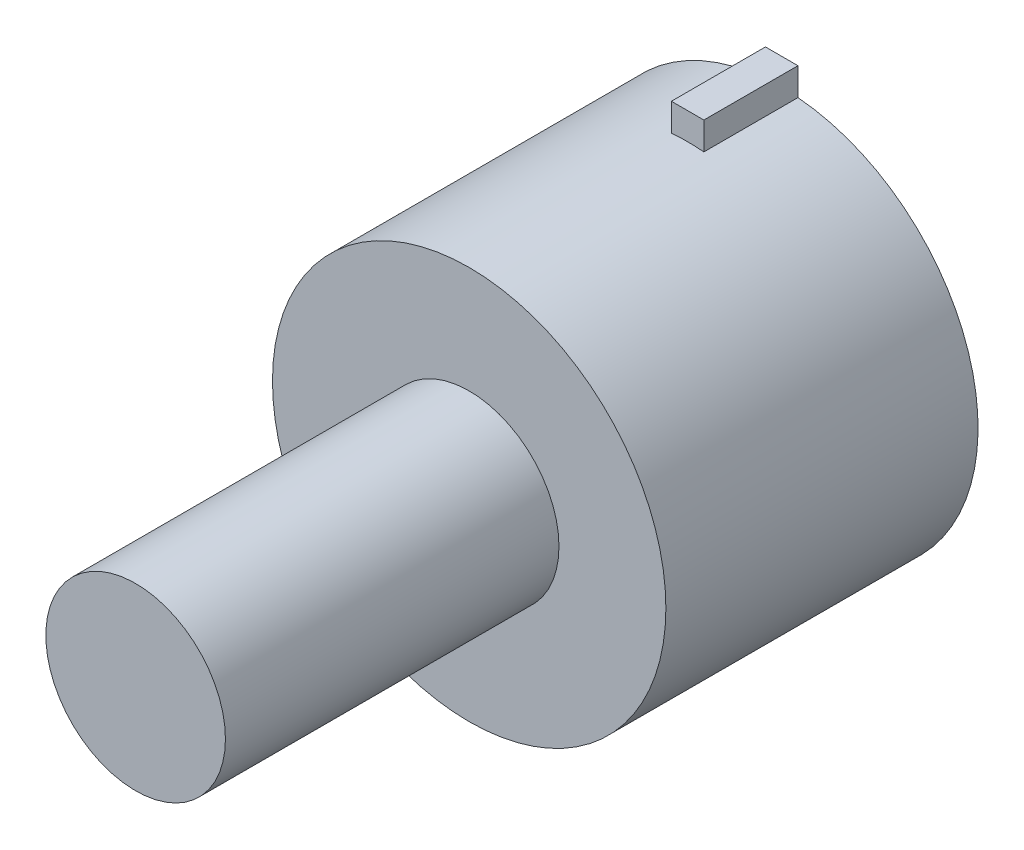
from build123d import *

# Parameters (mm, degrees)
SKETCH1_R           = 4.6
BOSS_EXTRUDE1_DEPTH = 7.3
SKETCH2_R           = 2.1
BOSS_EXTRUDE2_DEPTH = 7.8
BOSS_EXTRUDE3_START = -7.3
SKETCH3_W           = 0.76
SKETCH3_H           = 0.7
BOSS_EXTRUDE3_DEPTH = 2.2


with BuildPart() as part:
    # Sketch1 → Boss-Extrude1 (new body)
    with BuildSketch(Plane.XY):
        Circle(SKETCH1_R)
    extrude(amount=BOSS_EXTRUDE1_DEPTH)

    # Sketch2 → Boss-Extrude2 (add)
    with BuildSketch(Plane.XY.offset(7.3)):
        Circle(SKETCH2_R)
    extrude(amount=BOSS_EXTRUDE2_DEPTH)

    # Sketch3 → Boss-Extrude3 (add)
    with BuildSketch(Plane.XY.offset(7.3).offset(BOSS_EXTRUDE3_START)):
        with Locations((0.008541009, 4.88)):
            Rectangle(SKETCH3_W, SKETCH3_H)
    extrude(amount=BOSS_EXTRUDE3_DEPTH)


solid = part.part
